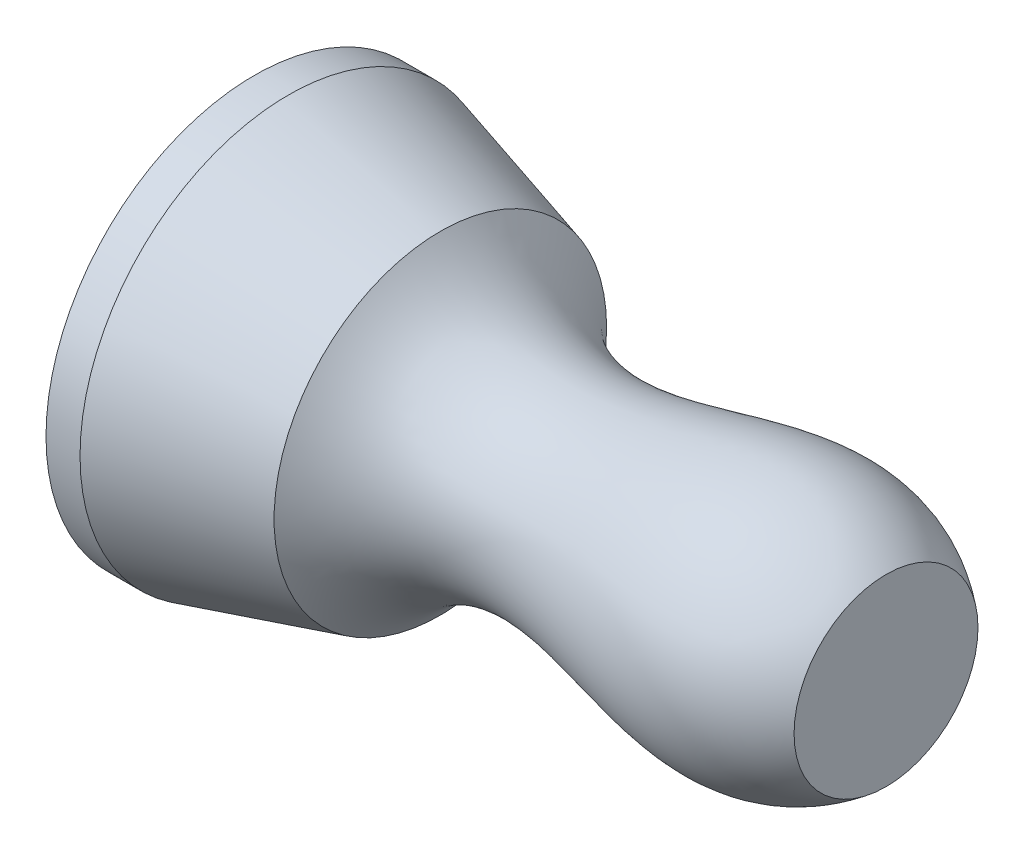
from build123d import *


with BuildPart() as part:
    # 草圖2 → 旋轉1 (revolve)
    with BuildSketch(Plane(origin=(0, 0, 0), x_dir=(1, 0, 0), z_dir=(0, 1, 0))):
        with BuildLine():
            Line((0, 0), (0, 19.008319468))
            Line((0, 19.008319468), (3.103399097, 19.008319468))
            Line((3.103399097, 19.008319468), (16.949333772, 15.160577205))
            add(Edge.make_bspline(
                [(16.949333772, 15.160577205), (29.03605975, -0.365645484), (43.873758232, 19.151202723), (57.590468472, 8.385819717)],
                knots=[0, 0, 0, 0, 1, 1, 1, 1], degree=3))
            Line((57.590468472, 8.385819717), (57.590468472, 0))
            Line((57.590468472, 0), (0, 0))
        make_face()
    revolve(axis=Axis((57.590468472, 0, 0), (-1, 0, 0)))


solid = part.part
